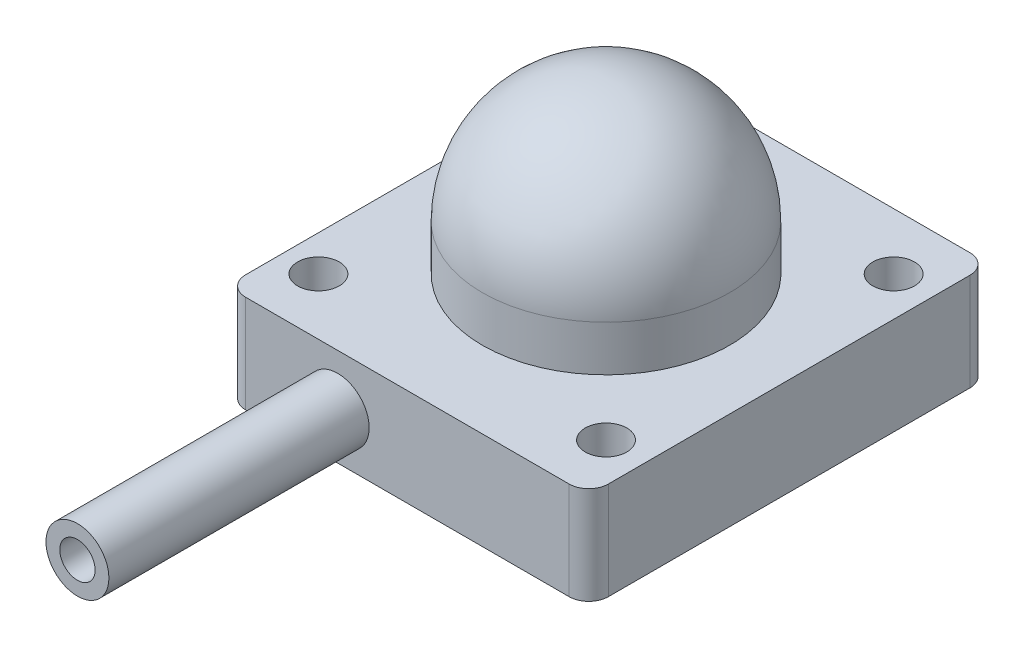
from build123d import *

# Parameters (mm, degrees)
SKETCH1_W           = 27.860395724
SKETCH1_H           = 30.792543072
SKETCH1_R           = 1.6
BOSS_EXTRUDE1_DEPTH = 7.5
SKETCH2_R           = 9.5
BOSS_EXTRUDE2_DEPTH = 3.5
REVOLVE3_ANGLE      = 180
FILLET1_R           = 1.5
SKETCH4_R           = 2.416047387
SKETCH4_R_2         = 1.358434459
BOSS_EXTRUDE3_DEPTH = 20


with BuildPart() as part:
    # Sketch1 → Boss-Extrude1 (new body)
    with BuildSketch(Plane(origin=(0, 0, 0), x_dir=(1, 0, 0), z_dir=(0, 1, 0))):
        with Locations((0.138729437, 0)):
            Rectangle(SKETCH1_W, SKETCH1_H)
        with Locations(Location((-11.05, 11.05, 0), (0, 0, 270))):
            Circle(SKETCH1_R, mode=Mode.SUBTRACT)
        with Locations(Location((11.05, 11.05, 0), (0, 0, 270))):
            Circle(SKETCH1_R, mode=Mode.SUBTRACT)
        with Locations(Location((-11.05, -11.05, 0), (0, 0, 90))):
            Circle(SKETCH1_R, mode=Mode.SUBTRACT)
        with Locations(Location((11.05, -11.05, 0), (0, 0, 90))):
            Circle(SKETCH1_R, mode=Mode.SUBTRACT)
    extrude(amount=BOSS_EXTRUDE1_DEPTH)

    # Sketch2 → Boss-Extrude2 (add)
    with BuildSketch(Plane(origin=(0, 7.5, 0), x_dir=(1, 0, 0), z_dir=(0, 1, 0))):
        with Locations(Location((0, 0, 0), (0, 0, 270))):
            Circle(SKETCH2_R)
    extrude(amount=BOSS_EXTRUDE2_DEPTH)

    # Sketch3 → Revolve3 (revolve)
    with BuildSketch(Plane(origin=(0, 11, 0), x_dir=(1, 0, 0), z_dir=(0, 1, 0))):
        with BuildLine():
            Line((-9.5, 0), (9.5, 0))
            ThreePointArc((9.5, 0), (0, 9.5), (-9.5, 0))
        make_face()
    revolve(axis=Axis((-9.5, 11, 0), (1, 0, 0)), revolution_arc=REVOLVE3_ANGLE)

    # Fillet1
    fillet1_edges = [part.edges().sort_by_distance(p)[0] for p in [
        (-13.791468425, 3.75, -15.396271536),
        (14.068927299, 3.75, -15.396271536),
        (14.068927299, 3.75, 15.396271536),
        (-13.791468425, 3.75, 15.396271536),
    ]]
    fillet(fillet1_edges, radius=FILLET1_R)

    # Sketch4 → Boss-Extrude3 (add)
    with BuildSketch(Plane.XY.offset(15.396271536)):
        with Locations(Location((-5.220214875, 3.559374136, 0), (0, 0, 180))):
            Circle(SKETCH4_R)
        with Locations((-5.220214875, 3.559374136)):
            Circle(SKETCH4_R_2, mode=Mode.SUBTRACT)
    extrude(amount=BOSS_EXTRUDE3_DEPTH)


solid = part.part
